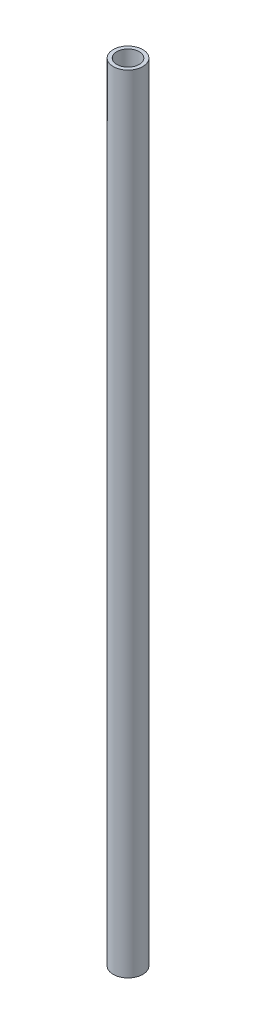
from build123d import *

# Parameters (mm, degrees)
SKETCH1_W = 0.4
SKETCH1_H = 87.9


with BuildPart() as part:
    # Sketch1 → Funda_PTFE (revolve)
    with BuildSketch(Plane.XY, mode=Mode.PRIVATE) as funda_ptfe_sk:
        with Locations((1.45, -82.95)):
            Rectangle(SKETCH1_W, SKETCH1_H)
    revolve(funda_ptfe_sk.sketch.rotate(Axis((0, -130.9, 0), (0, 1, 0)), 90), axis=Axis((0, -130.9, 0), (0, 1, 0)))


solid = part.part
